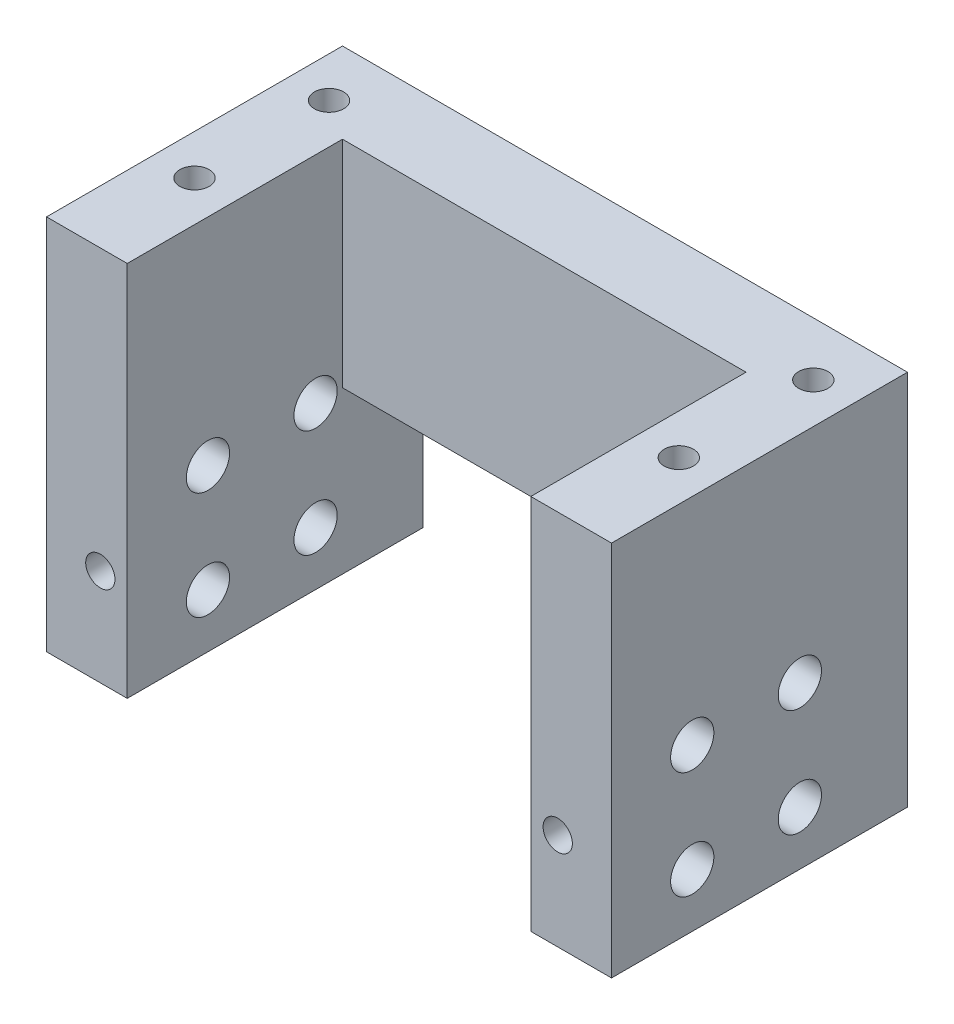
from build123d import *

# Parameters (mm, degrees)
SKETCH1_W                      = 66.675
SKETCH1_H                      = 34.925
BOSS_EXTRUDE1_DEPTH            = 38.1
SKETCH2_W                      = 47.625
SKETCH2_H                      = 25.4
CUT_EXTRUDE1_DEPTH             = 85.986868471
SKETCH3_W                      = 34.925
SKETCH3_H                      = 31.75
CUT_EXTRUDE2_DEPTH             = 79.753441393
SKETCH4_W                      = 47.625
SKETCH4_H                      = 38.1
CUT_EXTRUDE3_DEPTH             = 62.504101743
F_1_4_20_TAPPED_HOLE1_D        = 5.1054
F_1_4_20_TAPPED_HOLE1_DEPTH    = 9.526
F_8_32_TAPPED_HOLE2_AT_2_COUNT = 2
F_8_32_TAPPED_HOLE2_AT_2_PITCH = 15.875
LPATTERN1_COUNT                = 2
LPATTERN1_PITCH                = 12.7
MIRROR1_COPY_2_D               = 5.1054
MIRROR1_COPY_2_DEPTH           = 9.526


with BuildPart() as part:
    # Sketch1 → Boss-Extrude1 (new, symmetric)
    with BuildSketch(Plane(origin=(0, 0, 0), x_dir=(1, 0, 0), z_dir=(0, 1, 0))):
        Rectangle(SKETCH1_W, SKETCH1_H)
    extrude(amount=BOSS_EXTRUDE1_DEPTH, both=True)

    # Sketch2 → Cut-Extrude1 (cut, through all)
    with BuildSketch(Plane(origin=(0, 38.1, 0), x_dir=(1, 0, 0), z_dir=(0, 1, 0))):
        with Locations((0, -4.7625)):
            Rectangle(SKETCH2_W, SKETCH2_H)
    extrude(amount=-CUT_EXTRUDE1_DEPTH, mode=Mode.SUBTRACT)

    # Sketch3 → Cut-Extrude2 (cut, through all)
    with BuildSketch(Plane(origin=(33.3375, 0, 0), x_dir=(0, 0, -1), z_dir=(1, 0, 0))):
        with Locations((0, -22.225)):
            Rectangle(SKETCH3_W, SKETCH3_H)
    extrude(amount=-CUT_EXTRUDE2_DEPTH, mode=Mode.SUBTRACT)

    # Sketch4 → Cut-Extrude3 (cut, through all)
    with BuildSketch(Plane(origin=(0, 0, -17.4625), x_dir=(-1, 0, 0), z_dir=(0, 0, -1))):
        with Locations((0, -6.35)):
            Rectangle(SKETCH4_W, SKETCH4_H)
    extrude(amount=-CUT_EXTRUDE3_DEPTH, mode=Mode.SUBTRACT)

    # 1/4-20 Tapped Hole1
    with Locations(Plane(origin=(33.3375, 0, 0), x_dir=(0, 0, -1), z_dir=(1, 0, 0))):
        with Locations((-7.9375, 0), (4.7625, 0)):
            f_1_4_20_tapped_hole1 = Hole(F_1_4_20_TAPPED_HOLE1_D / 2, depth=F_1_4_20_TAPPED_HOLE1_DEPTH)

    # Sketch7 → #8-32 Tapped Hole1 (revolve, cut)
    with BuildSketch(Plane(origin=(26.9875, 5.08, 17.4625), x_dir=(0, -1, 0), z_dir=(1, 0, 0))):
        Polygon((0, 0), (0, 13.483806461), (1.7272, 12.446), (1.7272, 0), align=None)
    f_8_32_tapped_hole1 = revolve(axis=Axis((26.9875, 5.08, 23.8125), (0, 0, -1)), mode=Mode.SUBTRACT)

    # Sketch9 → #8-32 Tapped Hole2 (revolve, cut)
    with BuildSketch(Plane(origin=(28.575, 38.1, 4.7625), x_dir=(0, 0, 1), z_dir=(1, 0, 0))):
        Polygon((0, 0), (0, 13.483806461), (1.7272, 12.446), (1.7272, 0), align=None)
    f_8_32_tapped_hole2 = revolve(axis=Axis((28.575, 44.45, 4.7625), (0, -1, 0)), mode=Mode.SUBTRACT)

    # #8-32 Tapped Hole2 at 2: #8-32 Tapped Hole2 ×2
    with Locations(*[(0, 0, -i * F_8_32_TAPPED_HOLE2_AT_2_PITCH) for i in range(1, F_8_32_TAPPED_HOLE2_AT_2_COUNT)]):
        add(f_8_32_tapped_hole2, mode=Mode.SUBTRACT)

    # LPattern1: 1/4-20 Tapped Hole1 ×2
    with Locations(*[(0, i * LPATTERN1_PITCH, 0) for i in range(1, LPATTERN1_COUNT)]):
        add(f_1_4_20_tapped_hole1, mode=Mode.SUBTRACT)

    # Mirror1: 1/4-20 Tapped Hole1, #8-32 Tapped Hole1, #8-32 Tapped Hole2 across plane
    add(f_1_4_20_tapped_hole1.mirror(Plane(origin=(0, 0, 0), x_dir=(0, 0, 1), z_dir=(1, 0, 0))), mode=Mode.SUBTRACT)
    add(f_8_32_tapped_hole1.mirror(Plane(origin=(0, 0, 0), x_dir=(0, 0, 1), z_dir=(1, 0, 0))), mode=Mode.SUBTRACT)
    add(f_8_32_tapped_hole2.mirror(Plane(origin=(0, 0, 0), x_dir=(0, 0, 1), z_dir=(1, 0, 0))), mode=Mode.SUBTRACT)

    # Mirror1 copy 1 sketch → Mirror1 copy 1 (revolve, cut)
    with BuildSketch(Plane(origin=(-28.575, 38.1, -11.1125), x_dir=(0, 0, 1), z_dir=(-1, 0, 0))):
        Polygon((0, 0), (0, -13.483806461), (1.7272, -12.446), (1.7272, 0), align=None)
    revolve(axis=Axis((-28.575, 44.45, -11.1125), (0, 1, 0)), mode=Mode.SUBTRACT)

    # Mirror1 copy 2
    with Locations(Plane(origin=(-33.3375, 12.7, 0), x_dir=(0, 0, -1), z_dir=(-1, 0, 0))):
        with Locations((-7.9375, 0), (4.7625, 0)):
            Hole(MIRROR1_COPY_2_D / 2, depth=MIRROR1_COPY_2_DEPTH)


solid = part.part
